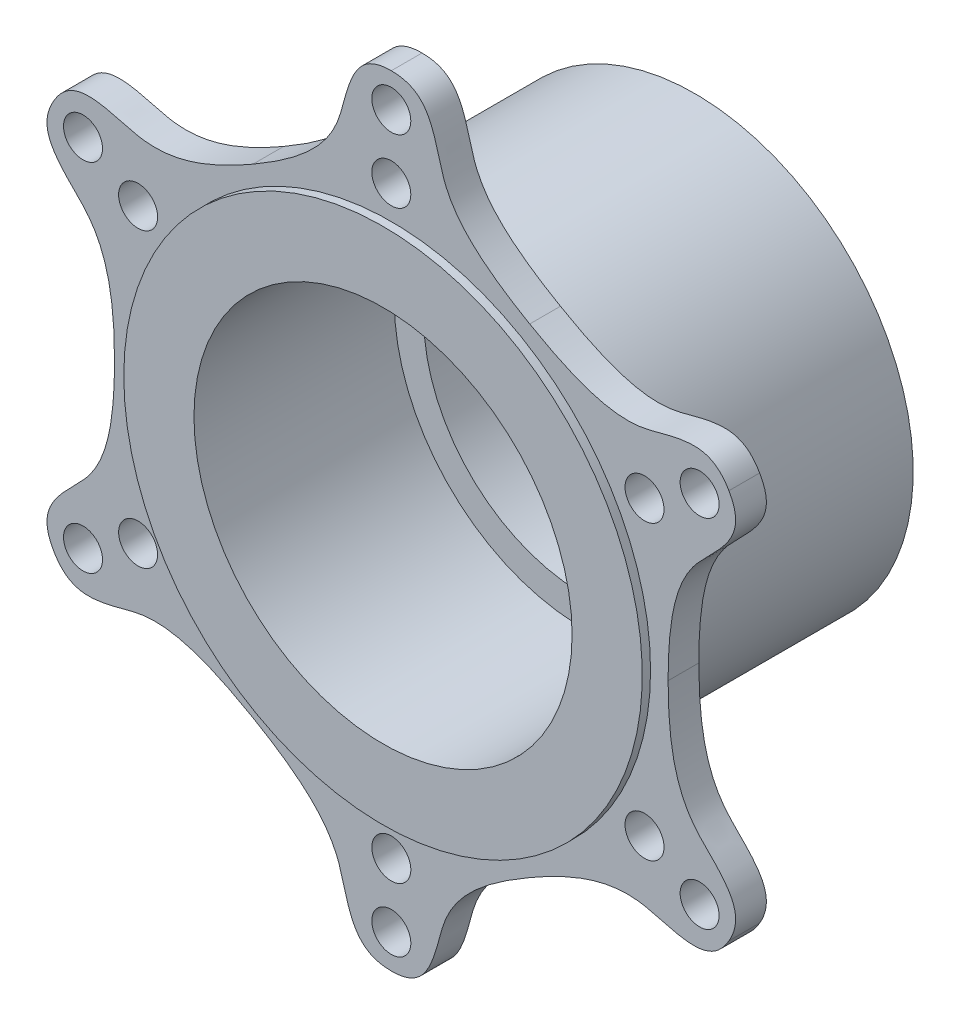
from build123d import *

# Parameters (mm, degrees)
EXTRUDE2_REACH      = 104.517
SKETCH3_R           = 3.175
CIRPATTERN2_COUNT   = 6
CUT_EXTRUDE1_DEPTH  = 101.199624223
CIRPATTERN4_COUNT   = 6
SKETCH10_R          = 42.2275
SKETCH10_R_2        = 30.7975
BOSS_EXTRUDE1_DEPTH = 1.35
SKETCH11_R          = 2.38125
CUT_EXTRUDE4_DEPTH  = 12.7
CIRPATTERN6_COUNT   = 6
FILLET1_R           = 0.79375


with BuildPart() as part:
    # Sketch1 → Revolve1 (revolve)
    with BuildSketch(Plane(origin=(0, 0, 0), x_dir=(0, 0, -1), z_dir=(1, 0, 0)), mode=Mode.PRIVATE) as revolve1_sk:
        Polygon((0, 63.5), (-5.0038, 63.5), (-5.0038, 30.7975), (26.2712, 30.7975), (26.2712, 26), (41.2712, 26), (41.2712, 22.825), (44.4462, 22.825), (44.4462, 35.56), (0, 35.56), align=None)
    revolve(revolve1_sk.sketch.rotate(Axis((0, 0, 0), (0, 0, 1)), 90), axis=Axis((0, 0, 0), (0, 0, 1)))

    # Sketch3 → Extrude2 (cut, up to next)
    with BuildSketch(Plane.XY.offset(5.0038), mode=Mode.PRIVATE) as extrude2_sk1:
        with Locations((0, 57.9882)):
            Circle(SKETCH3_R)
    extrude2_tool1 = extrude(extrude2_sk1.sketch, amount=-EXTRUDE2_REACH, mode=Mode.PRIVATE) & part.part
    # Sketch3 → Extrude2 (cut, up to next)
    with BuildSketch(Plane.XY.offset(5.0038), mode=Mode.PRIVATE) as extrude2_sk2:
        with Locations((0, 47.625)):
            Circle(SKETCH3_R)
    extrude2_tool2 = extrude(extrude2_sk2.sketch, amount=-EXTRUDE2_REACH, mode=Mode.PRIVATE) & part.part
    extrude2_1 = extrude2_tool1.solids().sort_by_distance((0, 57.9882, 5.0038))[0]
    add(extrude2_1, mode=Mode.SUBTRACT)
    extrude2_2 = extrude2_tool2.solids().sort_by_distance((0, 47.625, 5.0038))[0]
    add(extrude2_2, mode=Mode.SUBTRACT)
    extrude2 = extrude2_1 + extrude2_2  # Extrude2 as one shape, for the pattern or mirror that repeats it

    # CirPattern2: Extrude2 ×6 about axis
    cirpattern2_axis = Axis((0, 0, 0), (0, 0, 1))
    for i in range(1, CIRPATTERN2_COUNT):
        add(extrude2.rotate(cirpattern2_axis, i * 360 / CIRPATTERN2_COUNT), mode=Mode.SUBTRACT)

    # Sketch6 → Cut-Extrude1 (cut, through all)
    with BuildSketch(Plane.XY):
        with BuildLine():
            ThreePointArc((54.99261314, 31.75), (31.75, 54.99261314), (0, 63.5))
            add(Edge.make_bspline(
                [(0, 63.5), (5.056983961, 63.5), (6.711231133, 59.460169075), (9.488068515, 48.40363643), (14.667111584, 43.591612952), (22.5425, 39.04475533)],
                knots=[0, 0, 0, 0, 0.460560904, 0.560560904, 1, 1, 1, 1], degree=3))
            add(Edge.make_bspline(
                [(54.99261314, 31.75), (52.46412116, 36.129476577), (48.138401366, 35.54218119), (37.174744527, 32.418726582), (30.417888416, 34.497897708), (22.5425, 39.04475533)],
                knots=[0, 0, 0, 0, 0.460560904, 0.560560904, 1, 1, 1, 1], degree=3))
        make_face()
    cut_extrude1 = extrude(amount=CUT_EXTRUDE1_DEPTH, mode=Mode.SUBTRACT)

    # CirPattern4: Cut-Extrude1 ×6 about axis
    cirpattern4_axis = Axis((0, 0, -58.1544), (0, 0, 1))
    for i in range(1, CIRPATTERN4_COUNT):
        add(cut_extrude1.rotate(cirpattern4_axis, i * 360 / CIRPATTERN4_COUNT), mode=Mode.SUBTRACT)

    # Sketch10 → Boss-Extrude1 (add)
    with BuildSketch(Plane.XY.offset(5.0038)):
        with Locations(Location((0, 0, 0), (0, 0, 180))):
            Circle(SKETCH10_R)
        with Locations(Location((0, 0, 0), (0, 0, 180))):
            Circle(SKETCH10_R_2, mode=Mode.SUBTRACT)
    extrude(amount=BOSS_EXTRUDE1_DEPTH)

    # Sketch11 → Cut-Extrude4 (cut)
    with BuildSketch(Plane(origin=(0, 0, -44.4462), x_dir=(-1, 0, 0), z_dir=(0, 0, -1))):
        with Locations((0, 30.95625)):
            Circle(SKETCH11_R)
    cut_extrude4 = extrude(amount=-CUT_EXTRUDE4_DEPTH, mode=Mode.SUBTRACT)

    # CirPattern6: Cut-Extrude4 ×6 about axis
    cirpattern6_axis = Axis((0, 0, 0), (0, 0, 1))
    for i in range(1, CIRPATTERN6_COUNT):
        add(cut_extrude4.rotate(cirpattern6_axis, i * 360 / CIRPATTERN6_COUNT), mode=Mode.SUBTRACT)

    # Fillet1
    fillet1_edges = [part.edges().sort_by_distance(p)[0] for p in [
        (35.56, 0, 0),
    ]]
    fillet(fillet1_edges, radius=FILLET1_R)


solid = part.part
